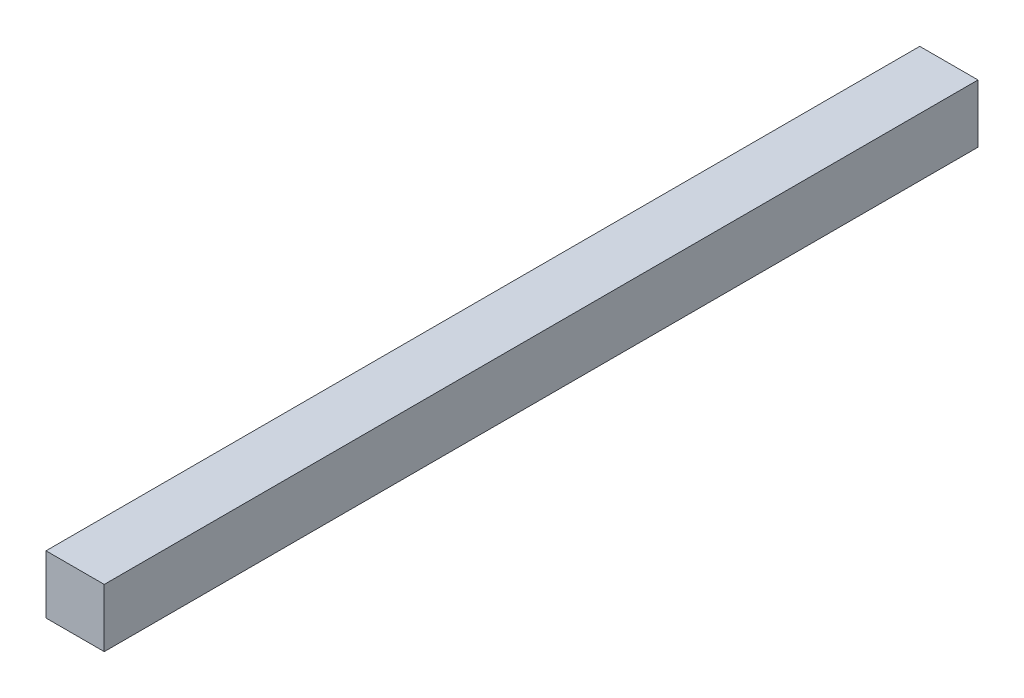
from build123d import *

# Parameters (mm, degrees)
SKETCH_1_W      = 20
SKETCH_1_H      = 20
EXTRUDE_1_DEPTH = 300


with BuildPart() as part:
    # 草圖1 → 填料-伸長1 (new body)
    with BuildSketch(Plane.XY):
        Rectangle(SKETCH_1_W, SKETCH_1_H)
    extrude(amount=EXTRUDE_1_DEPTH)


solid = part.part
